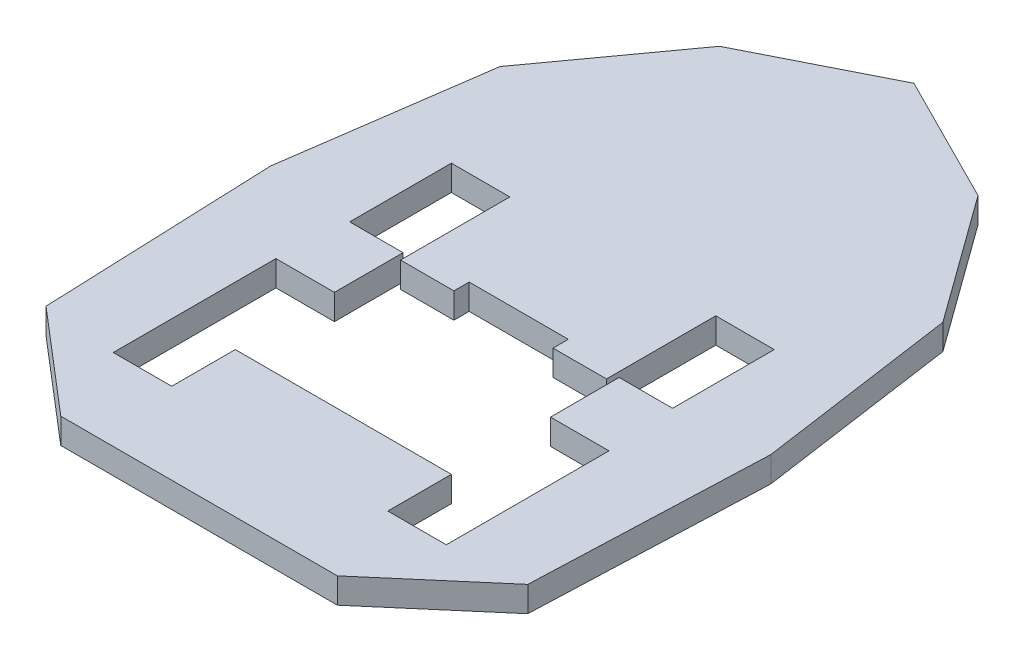
from build123d import *

# Parameters (mm, degrees)
BOSS_EXTRUDE1_DEPTH = 50


with BuildPart() as part:
    # Sketch1 → Boss-Extrude1 (new body)
    with BuildSketch(Plane(origin=(0, 0, 0), x_dir=(1, 0, 0), z_dir=(0, 1, 0))):
        Polygon((-434.22123396, 330.511591748), (-490.415824699, -64.194072769), (-472.477870031, -524.138824529), (-270.660991621, -696.876695154), (273.24324441, -696.876695154), (475.06012282, -524.138824529), (492.998077488, -64.194072769), (436.803486749, 330.511591748), (255.52688097, 580.827312496), (1.291126394, 709.058947943), (-252.944628181, 580.827312496), align=None)
        Polygon((327.5, -536.876695154), (212.5, -536.876695154), (212.5, -411.876695154), (97.5, -411.876695154), (-97.5, -411.876695154), (-212.5, -411.876695154), (-212.5, -536.876695154), (-327.5, -536.876695154), (-327.5, -216.876695154), (-212.5, -216.876695154), (-212.5, -96.876695154), (-212.5, -81.876695154), (-317.5, -81.876695154), (-317.5, 118.123304846), (-202.5, 118.123304846), (-202.5, -81.876695154), (-202.5, -96.876695154), (-97.5, -96.876695154), (-97.5, -66.876695154), (97.5, -66.876695154), (97.5, -96.876695154), (202.5, -96.876695154), (202.5, -81.876695154), (202.5, 118.123304846), (317.5, 118.123304846), (317.5, -81.876695154), (212.5, -81.876695154), (212.5, -96.876695154), (212.5, -216.876695154), (327.5, -216.876695154), align=None, mode=Mode.SUBTRACT)
    extrude(amount=-BOSS_EXTRUDE1_DEPTH)


solid = part.part
